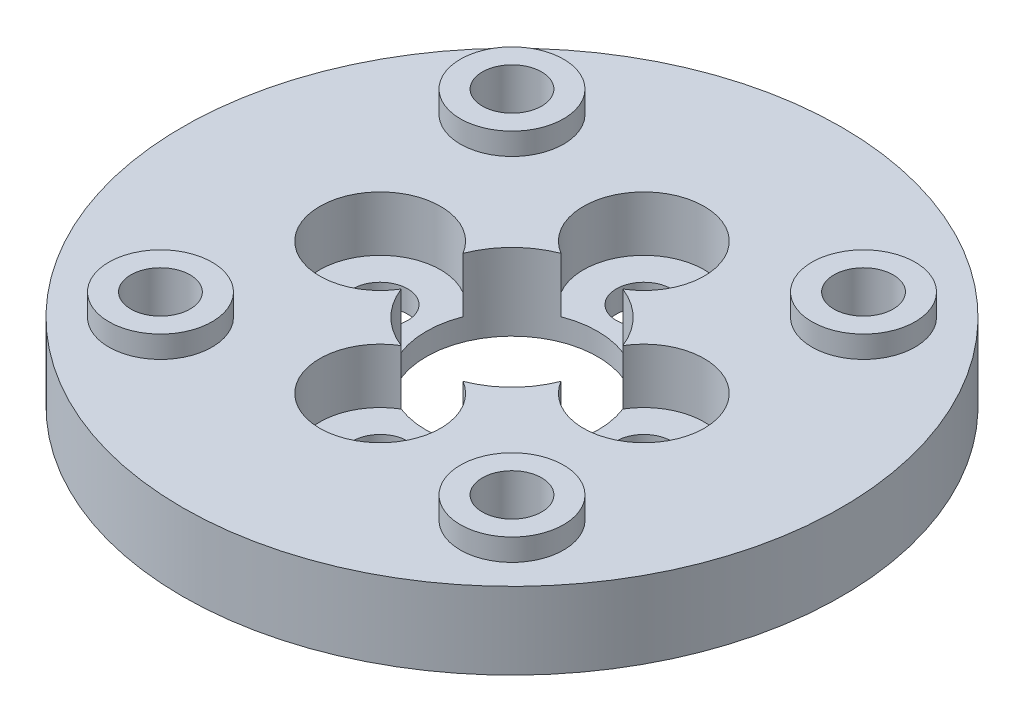
from build123d import *

# Parameters (mm, degrees)
SKETCH1_R                               = 15
BOSS_EXTRUDE1_DEPTH                     = 3.5
SKETCH2_R                               = 3.9
CUT_EXTRUDE1_DEPTH                      = 22.5
CBORE_FOR_M5_HEX_HEAD_BOLT1_D           = 2.5
CBORE_FOR_M5_HEX_HEAD_BOLT1_CBORE_D     = 5.5
CBORE_FOR_M5_HEX_HEAD_BOLT1_CBORE_DEPTH = 2.5
TAP_DRILL_FOR_M3X0_5_TAP1_D             = 2.7
SKETCH9_R                               = 2.35
SKETCH9_R_2                             = 1.35
BOSS_EXTRUDE2_DEPTH                     = 1


with BuildPart() as part:
    # Sketch1 → Boss-Extrude1 (new body)
    with BuildSketch(Plane(origin=(0, 0, 0), x_dir=(1, 0, 0), z_dir=(0, 1, 0))):
        with Locations(Location((0, 0, 0), (0, 0, 90))):
            Circle(SKETCH1_R)
    extrude(amount=BOSS_EXTRUDE1_DEPTH)

    # Sketch2 → Cut-Extrude1 (cut, through all)
    with BuildSketch(Plane(origin=(0, 3.5, 0), x_dir=(1, 0, 0), z_dir=(0, 1, 0))):
        with Locations(Location((0, 0, 0), (0, 0, 270))):
            Circle(SKETCH2_R)
    extrude(amount=-CUT_EXTRUDE1_DEPTH, mode=Mode.SUBTRACT)

    # CBORE for M5 Hex Head Bolt1 (through all)
    with Locations(Plane(origin=(0, 3.5, 0), x_dir=(1, 0, 0), z_dir=(0, 1, 0))):
        with Locations((-6, 0), (0, 6), (6, 0), (0, -6)):
            CounterBoreHole(CBORE_FOR_M5_HEX_HEAD_BOLT1_D / 2, CBORE_FOR_M5_HEX_HEAD_BOLT1_CBORE_D / 2, CBORE_FOR_M5_HEX_HEAD_BOLT1_CBORE_DEPTH)

    # Tap Drill for M3x0.5 Tap1 (through all)
    with Locations(Plane(origin=(0, 3.5, 0), x_dir=(1, 0, 0), z_dir=(0, 1, 0))):
        with Locations((-8, 8), (8, 8), (8, -8), (-8, -8)):
            Hole(TAP_DRILL_FOR_M3X0_5_TAP1_D / 2)

    # Sketch9 → Boss-Extrude2 (add)
    # profile 1 of 4: a face of its own
    with BuildSketch(Plane(origin=(0, 3.5, 0), x_dir=(1, 0, 0), z_dir=(0, 1, 0))):
        with Locations(Location((8, -8, 0), (0, 0, 270))):
            Circle(SKETCH9_R)
        with Locations(Location((8, -8, 0), (0, 0, 270))):
            Circle(SKETCH9_R_2, mode=Mode.SUBTRACT)
    # profile 2 of 4: a face of its own
    with BuildSketch(Plane(origin=(0, 3.5, 0), x_dir=(1, 0, 0), z_dir=(0, 1, 0))):
        with Locations(Location((8, 8, 0), (0, 0, 270))):
            Circle(SKETCH9_R)
        with Locations(Location((8, 8, 0), (0, 0, 270))):
            Circle(SKETCH9_R_2, mode=Mode.SUBTRACT)
    # profile 3 of 4: a face of its own
    with BuildSketch(Plane(origin=(0, 3.5, 0), x_dir=(1, 0, 0), z_dir=(0, 1, 0))):
        with Locations(Location((-8, -8, 0), (0, 0, 270))):
            Circle(SKETCH9_R)
        with Locations(Location((-8, -8, 0), (0, 0, 270))):
            Circle(SKETCH9_R_2, mode=Mode.SUBTRACT)
    # profile 4 of 4: a face of its own
    with BuildSketch(Plane(origin=(0, 3.5, 0), x_dir=(1, 0, 0), z_dir=(0, 1, 0))):
        with Locations(Location((-8, 8, 0), (0, 0, 270))):
            Circle(SKETCH9_R)
        with Locations(Location((-8, 8, 0), (0, 0, 270))):
            Circle(SKETCH9_R_2, mode=Mode.SUBTRACT)
    extrude(amount=BOSS_EXTRUDE2_DEPTH)


solid = part.part
